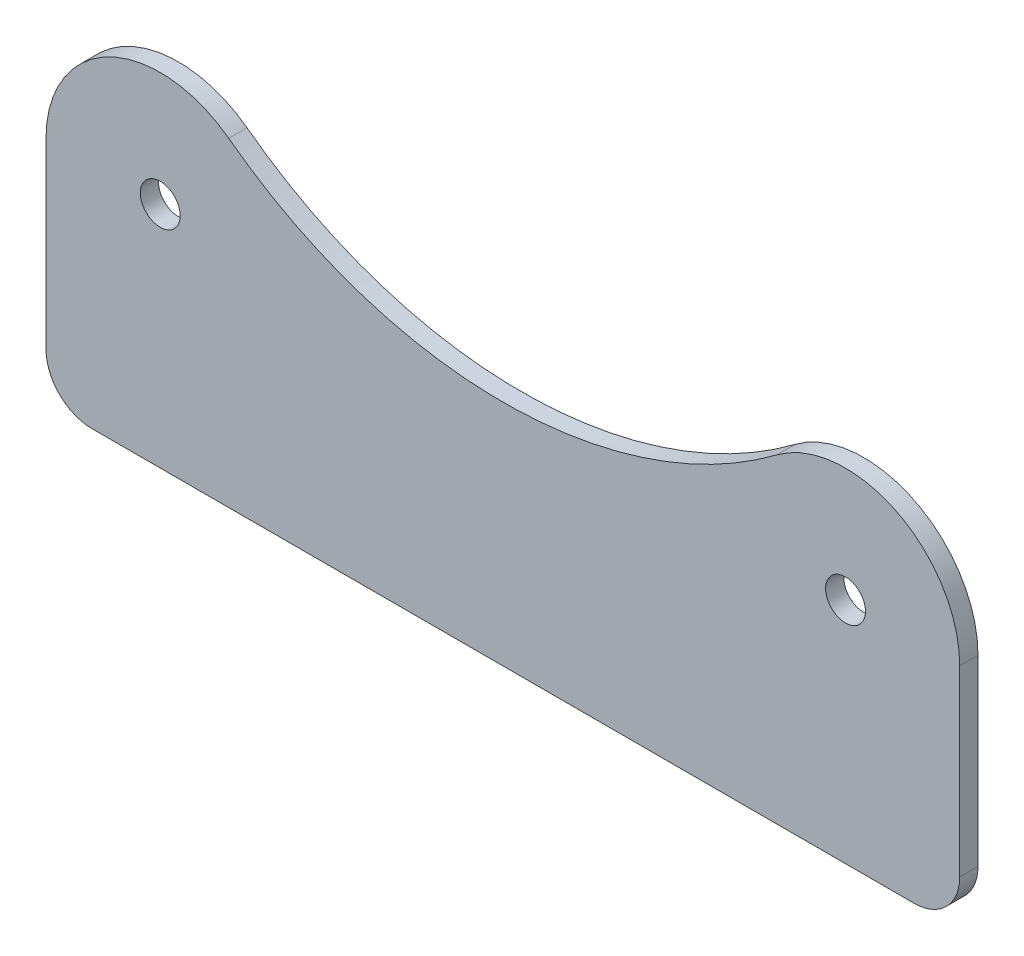
from build123d import *

# Parameters (mm, degrees)
SKETCH1_R           = 4.365625
BOSS_EXTRUDE1_DEPTH = 4


with BuildPart() as part:
    # Sketch1 → Boss-Extrude1 (new body)
    with BuildSketch(Plane.XY):
        with BuildLine():
            Line((10, 0), (190, 0))
            ThreePointArc((190, 0), (197.071067812, 2.928932188), (200, 10))
            Line((200, 10), (200, 50))
            ThreePointArc((200, 50), (186.180339887, 72.360679775), (160, 70))
            ThreePointArc((160, 70), (100, 50), (40, 70))
            ThreePointArc((40, 70), (13.819660113, 72.360679775), (0, 50))
            Line((0, 50), (0, 10))
            ThreePointArc((0, 10), (2.928932188, 2.928932188), (10, 0))
        make_face()
        with Locations((25, 50)):
            Circle(SKETCH1_R, mode=Mode.SUBTRACT)
        with Locations((175, 50)):
            Circle(SKETCH1_R, mode=Mode.SUBTRACT)
    extrude(amount=BOSS_EXTRUDE1_DEPTH)


solid = part.part
